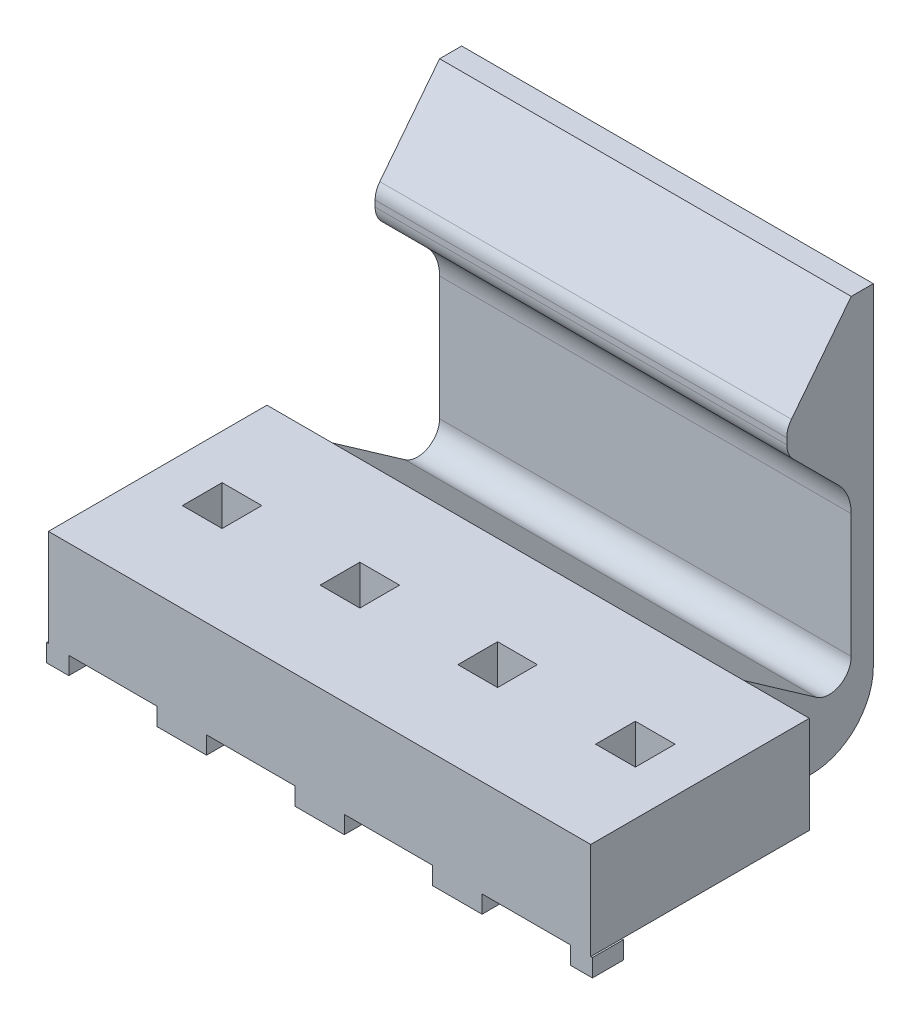
from build123d import *

# Parameters (mm, degrees)
SKETCH51_W           = 6.2865
SKETCH51_H           = 2.794
BOSS_EXTRUDE23_DEPTH = 7.8
SKETCH49_W           = 1.143
SKETCH49_H           = 1.143
CUT_EXTRUDE22_DEPTH  = 9.861515478
BOSS_EXTRUDE24_DEPTH = 5.92
SKETCH52_W           = 0.635
SKETCH52_H           = 0.889
SKETCH52_W_2         = 1.4224
BOSS_EXTRUDE25_DEPTH = 0.508
SCALE1_SCALE         = 0.654


with BuildPart() as part:
    # Sketch51 → Boss-Extrude23 (new, symmetric)
    with BuildSketch(Plane(origin=(0, 0, 0), x_dir=(0, 0, -1), z_dir=(1, 0, 0))):
        Rectangle(SKETCH51_W, SKETCH51_H)
    extrude(amount=BOSS_EXTRUDE23_DEPTH, both=True)

    # Sketch49 → Cut-Extrude22 (cut, through all)
    with BuildSketch(Plane(origin=(0, 1.397, 0), x_dir=(1, 0, 0), z_dir=(0, 1, 0))):
        with Locations((1.9812, -0.003489448)):
            Rectangle(SKETCH49_W, SKETCH49_H)
        with Locations((5.9436, -0.003489448)):
            Rectangle(SKETCH49_W, SKETCH49_H)
        with Locations((-1.9812, -0.003489448)):
            Rectangle(SKETCH49_W, SKETCH49_H)
        with Locations((-5.9436, -0.003489448)):
            Rectangle(SKETCH49_W, SKETCH49_H)
    extrude(amount=-CUT_EXTRUDE22_DEPTH, mode=Mode.SUBTRACT)

    # Sketch50 → Boss-Extrude24 (add, symmetric)
    with BuildSketch(Plane(origin=(0, 0, 0), x_dir=(0, 0, -1), z_dir=(1, 0, 0))):
        with BuildLine():
            Line((3.14325, -1.905), (5.08635, -1.905))
            ThreePointArc((5.08635, -1.905), (6.343585857, -1.384235857), (6.86435, -0.127))
            Line((6.86435, -0.127), (6.86435, 9.4234))
            Line((6.86435, 9.4234), (6.22935, 9.4234))
            Line((6.22935, 9.4234), (4.509763171, 7.222429228))
            ThreePointArc((4.509763171, 7.222429228), (4.409745704, 7.038219969), (4.37515, 6.831484191))
            Line((4.37515, 6.831484191), (4.37515, 6.655190003))
            ThreePointArc((4.37515, 6.655190003), (4.423486497, 6.412186024), (4.561137194, 6.206177197))
            Line((4.561137194, 6.206177197), (5.857375612, 4.909938779))
            ThreePointArc((5.857375612, 4.909938779), (6.132677006, 4.497921126), (6.22935, 4.011913167))
            Line((6.22935, 4.011913167), (6.22935, 0.455913167))
            ThreePointArc((6.22935, 0.455913167), (5.887560369, -0.107338712), (5.230128963, -0.064248381))
            Line((5.230128963, -0.064248381), (3.14325, 1.397))
            Line((3.14325, 1.397), (3.14325, -1.905))
        make_face()
    extrude(amount=BOSS_EXTRUDE24_DEPTH, both=True)

    # Sketch52 → Boss-Extrude25 (add)
    with BuildSketch(Plane(origin=(0, -1.397, 0), x_dir=(1, 0, 0), z_dir=(0, 1, 0))):
        with Locations((7.5311, -2.69875)):
            Rectangle(SKETCH52_W, SKETCH52_H)
        with Locations((0, -2.69875)):
            Rectangle(SKETCH52_W_2, SKETCH52_H)
        with Locations((3.9624, -2.69875)):
            Rectangle(SKETCH52_W_2, SKETCH52_H)
        with Locations((-3.9624, -2.69875)):
            Rectangle(SKETCH52_W_2, SKETCH52_H)
        with Locations((-7.5311, -2.69875)):
            Rectangle(SKETCH52_W, SKETCH52_H)
    extrude(amount=-BOSS_EXTRUDE25_DEPTH)


with BuildPart() as part_1:
    # Scale1: scaled about (0, 1.420456249, -2.517201016)
    add(part.part.scale(SCALE1_SCALE).moved(Location((0, 0.491477862, -0.870951552))))


solid = part_1.part
